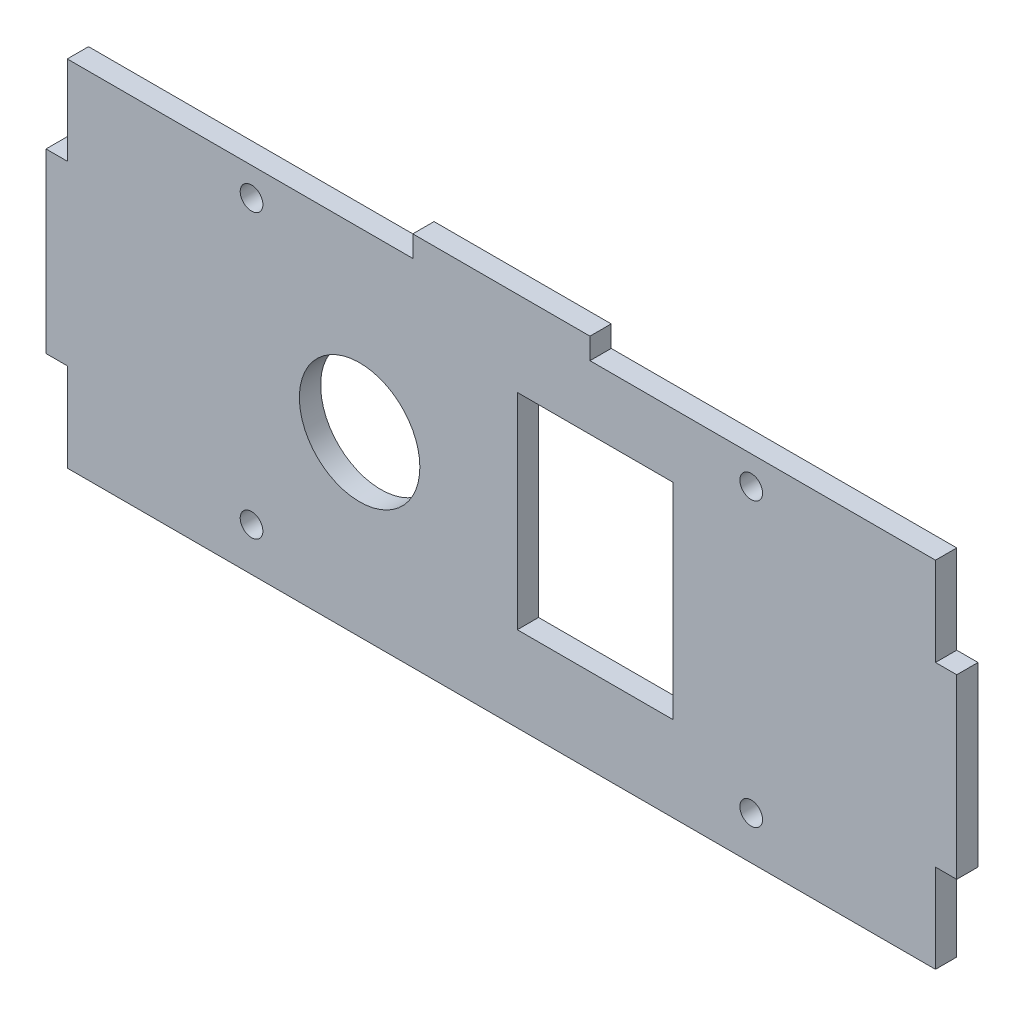
from build123d import *

# Parameters (mm, degrees)
BOSS_EXTRU_1_DEPTH = 3
SKETCH1_R          = 1.6
CUT_EXTRUDE1_DEPTH = 71.150285103
SKETCH2_R          = 1.6
CUT_EXTRUDE2_DEPTH = 71.150285103
SKETCH3_R          = 1.6
CUT_EXTRUDE3_DEPTH = 71.150285103
SKETCH4_W          = 22
SKETCH4_H          = 29
CUT_EXTRUDE4_DEPTH = 71.150285103
SKETCH5_R          = 8.5
CUT_EXTRUDE5_DEPTH = 71.150285103


with BuildPart() as part:
    # Esquisse1 → Boss.-Extru.1 (new body)
    with BuildSketch(Plane.XY):
        Polygon((61.25, -25), (-61.25, -25), (-61.25, -12.5), (-64.25, -12.5), (-64.25, 12.5), (-61.25, 12.5), (-61.25, 25), (-29.85, 25), (-26.65, 25), (-12.5, 25), (-12.5, 28), (12.5, 28), (12.5, 25), (26.65, 25), (29.85, 25), (61.25, 25), (61.25, 12.5), (64.25, 12.5), (64.25, -12.5), (61.25, -12.5), align=None)
    extrude(amount=BOSS_EXTRU_1_DEPTH)

    # Sketch1 → Cut-Extrude1 (cut, through all)
    with BuildSketch(Plane(origin=(0, 0, 0), x_dir=(-1, 0, 0), z_dir=(0, 0, -1))):
        with Locations((35.25, 21)):
            Circle(SKETCH1_R)
    extrude(amount=-CUT_EXTRUDE1_DEPTH, mode=Mode.SUBTRACT)

    # Sketch2 → Cut-Extrude2 (cut, through all)
    with BuildSketch(Plane(origin=(0, 0, 0), x_dir=(-1, 0, 0), z_dir=(0, 0, -1))):
        with Locations((-35.25, 21)):
            Circle(SKETCH2_R)
    extrude(amount=-CUT_EXTRUDE2_DEPTH, mode=Mode.SUBTRACT)

    # Sketch3 → Cut-Extrude3 (cut, through all)
    with BuildSketch(Plane(origin=(0, 0, 0), x_dir=(-1, 0, 0), z_dir=(0, 0, -1))):
        with Locations((35.25, -18.9)):
            Circle(SKETCH3_R)
        with Locations((-35.25, -18.9)):
            Circle(SKETCH3_R)
    extrude(amount=-CUT_EXTRUDE3_DEPTH, mode=Mode.SUBTRACT)

    # Sketch4 → Cut-Extrude4 (cut, through all)
    with BuildSketch(Plane.XY.offset(3)):
        with Locations((13.25, 1.5)):
            Rectangle(SKETCH4_W, SKETCH4_H)
    extrude(amount=-CUT_EXTRUDE4_DEPTH, mode=Mode.SUBTRACT)

    # Sketch5 → Cut-Extrude5 (cut, through all)
    with BuildSketch(Plane.XY.offset(3)):
        with Locations((-20, 0)):
            Circle(SKETCH5_R)
    extrude(amount=-CUT_EXTRUDE5_DEPTH, mode=Mode.SUBTRACT)


solid = part.part
